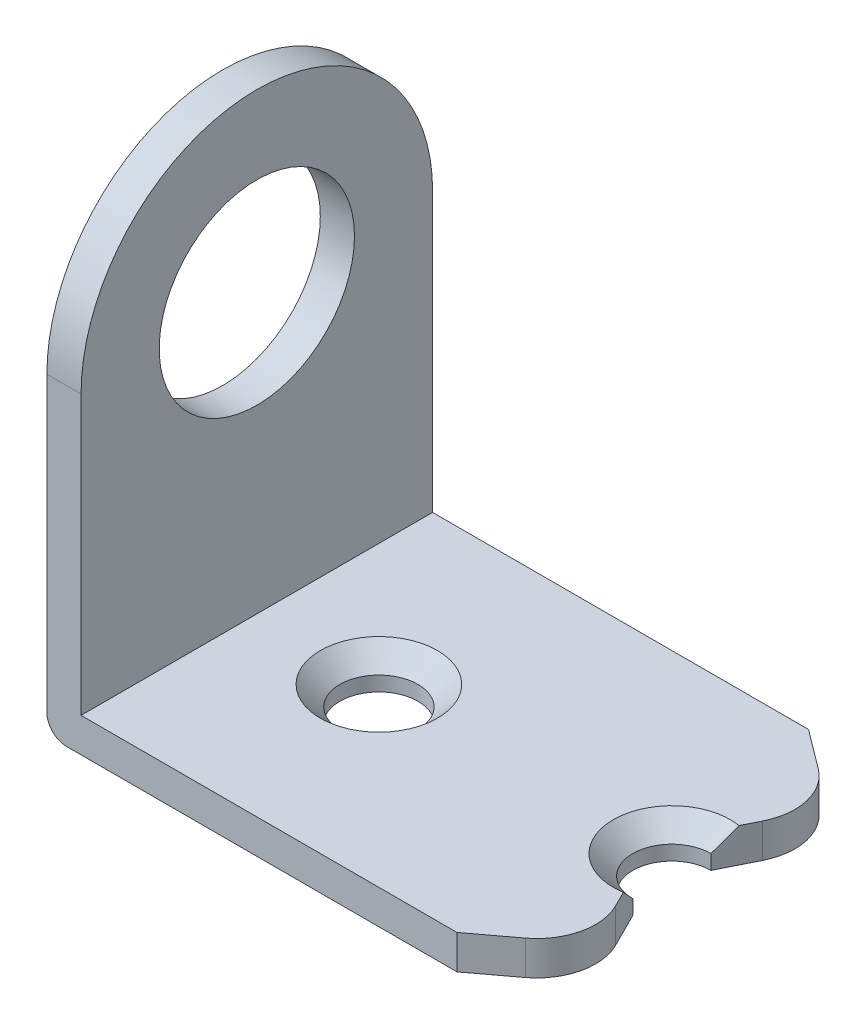
from build123d import *

# Parameters (mm, degrees)
SKETCH_1_W          = 28
SKETCH_1_H          = 18
SKETCH_1_R          = 2
EXTRUDE_1_DEPTH     = 1.75
SKETCH_2_R          = 5
EXTRUDE_2_DEPTH     = 1.75
FILLET_1_R          = 1
CHAMFER_1_SIZE      = 1
CUT_EXTRUDE_1_REACH = 40.601


with BuildPart() as part:
    # Эскиз1 → Бобышка-Вытянуть1 (new body)
    with BuildSketch(Plane(origin=(0, 0, 0), x_dir=(1, 0, 0), z_dir=(0, 1, 0))):
        with Locations((14, 0)):
            Rectangle(SKETCH_1_W, SKETCH_1_H)
        with Locations(Location((8, 0, 0), (0, 0, 270))):
            Circle(SKETCH_1_R, mode=Mode.SUBTRACT)
        with Locations(Location((23, 0, 0), (0, 0, 270))):
            Circle(SKETCH_1_R, mode=Mode.SUBTRACT)
    extrude(amount=EXTRUDE_1_DEPTH)

    # Эскиз2 → Бобышка-Вытянуть2 (add)
    with BuildSketch(Plane(origin=(0, 0, 0), x_dir=(0, 0, -1), z_dir=(1, 0, 0))):
        with BuildLine():
            Line((-9, 0), (-9, 16))
            ThreePointArc((-9, 16), (0, 25), (9, 16))
            Line((9, 16), (9, 0))
            Line((9, 0), (-9, 0))
        make_face()
        with Locations((0, 16)):
            Circle(SKETCH_2_R, mode=Mode.SUBTRACT)
    extrude(amount=EXTRUDE_2_DEPTH)

    # Скругление1
    fillet_1_edges = [part.edges().sort_by_distance(p)[0] for p in [
        (0, 0, 0),
    ]]
    fillet(fillet_1_edges, radius=FILLET_1_R)

    # Фаска1
    chamfer_1_edges = [part.edges().sort_by_distance(p)[0] for p in [
        (8, 1.75, -2),
        (23, 1.75, -2),
    ]]
    chamfer(chamfer_1_edges, length=CHAMFER_1_SIZE)

    # Эскиз3 → Вырез-Вытянуть1 (cut, up to next)
    with BuildSketch(Plane(origin=(0, 0, 0), x_dir=(-1, 0, 0), z_dir=(0, -1, 0)), mode=Mode.PRIVATE) as cut_extrude_1_sk1:
        with BuildLine():
            ThreePointArc((-25, 0), (-24.414213562, 1.414213562), (-23, 2))
            Line((-23, 2), (-23.880298325, 3.76059665))
            ThreePointArc((-23.880298325, 3.76059665), (-24.11676372, 5.791496198), (-22.997016752, 7.502237436))
            Line((-22.997016752, 7.502237436), (-21, 9))
            Line((-21, 9), (-28, 9))
            Line((-28, 9), (-28, 0))
            Line((-28, 0), (-25, 0))
        make_face()
    cut_extrude_1_tool1 = extrude(cut_extrude_1_sk1.sketch, amount=-CUT_EXTRUDE_1_REACH, mode=Mode.PRIVATE) & part.part
    # Эскиз3 → Вырез-Вытянуть1 (cut, up to next)
    with BuildSketch(Plane(origin=(0, 0, 0), x_dir=(-1, 0, 0), z_dir=(0, -1, 0)), mode=Mode.PRIVATE) as cut_extrude_1_sk2:
        with BuildLine():
            ThreePointArc((-23, -2), (-24.414213562, -1.414213562), (-25, 0))
            Line((-25, 0), (-28, 0))
            Line((-28, 0), (-28, -9))
            Line((-28, -9), (-21, -9))
            Line((-21, -9), (-22.997016752, -7.502237436))
            ThreePointArc((-22.997016752, -7.502237436), (-24.11676372, -5.791496198), (-23.880298325, -3.76059665))
            Line((-23.880298325, -3.76059665), (-23, -2))
        make_face()
    cut_extrude_1_tool2 = extrude(cut_extrude_1_sk2.sketch, amount=-CUT_EXTRUDE_1_REACH, mode=Mode.PRIVATE) & part.part
    add(cut_extrude_1_tool1.solids().sort_by_distance((25.731211, 0, -4.895819))[0], mode=Mode.SUBTRACT)
    add(cut_extrude_1_tool2.solids().sort_by_distance((25.731211, 0, 4.895819))[0], mode=Mode.SUBTRACT)


solid = part.part
